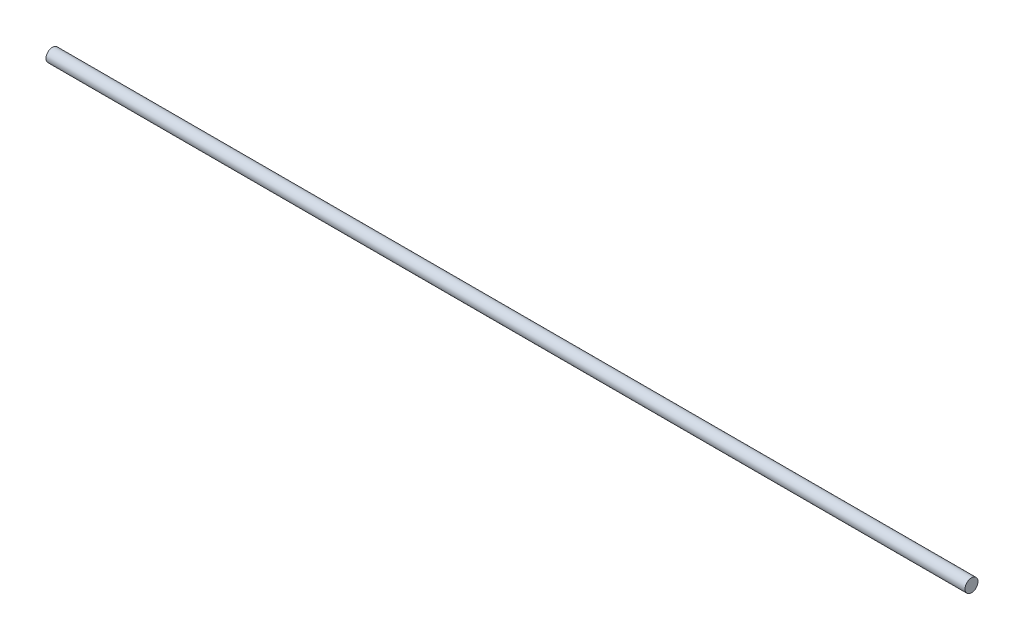
from build123d import *

# Parameters (mm, degrees)
SKETCH1_R           = 6.35
BOSS_EXTRUDE1_DEPTH = 898.392719524


with BuildPart() as part:
    # Sketch1 → Boss-Extrude1 (new body)
    with BuildSketch(Plane.YZ):
        with Locations(Location((0, 0, 0), (0, 0, 270))):
            Circle(SKETCH1_R)
    extrude(amount=BOSS_EXTRUDE1_DEPTH)


solid = part.part
